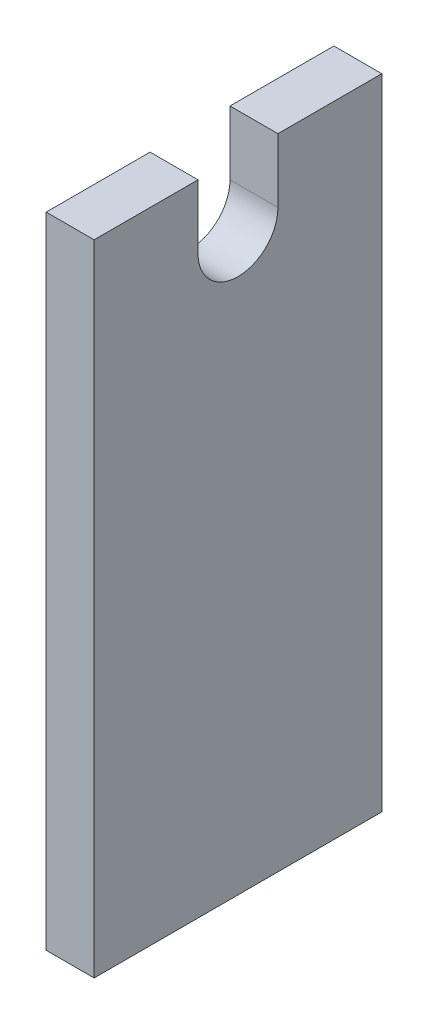
from build123d import *

# Parameters (mm, degrees)
SKETCH2_W           = 114.3
SKETCH2_H           = 254
BOSS_EXTRUDE1_DEPTH = 19.05
CUT_EXTRUDE1_DEPTH  = 280.1834388


with BuildPart() as part:
    # Sketch2 → Boss-Extrude1 (new body)
    with BuildSketch(Plane(origin=(0, 0, 0), x_dir=(0, 0, -1), z_dir=(1, 0, 0))):
        with Locations((57.15, 127)):
            Rectangle(SKETCH2_W, SKETCH2_H)
    extrude(amount=BOSS_EXTRUDE1_DEPTH)

    # Sketch3 → Cut-Extrude1 (cut, through all)
    with BuildSketch(Plane(origin=(19.05, 0, 0), x_dir=(0, 0, -1), z_dir=(1, 0, 0))):
        with BuildLine():
            Line((73.025, 254), (41.275, 254))
            Line((41.275, 254), (41.275, 228.6))
            ThreePointArc((41.275, 228.6), (57.15, 212.725), (73.025, 228.6))
            Line((73.025, 228.6), (73.025, 254))
        make_face()
    extrude(amount=-CUT_EXTRUDE1_DEPTH, mode=Mode.SUBTRACT)


solid = part.part
